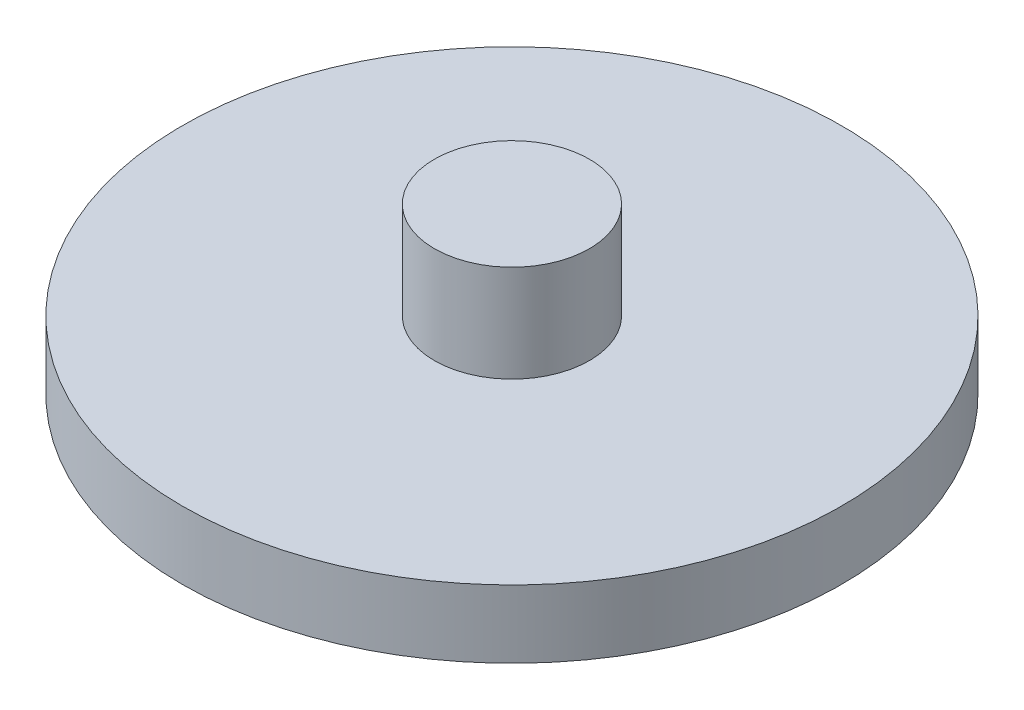
from build123d import *

# Parameters (mm, degrees)
SKETCH1_R           = 34
BOSS_EXTRUDE1_DEPTH = 7
SKETCH2_R           = 8
BOSS_EXTRUDE2_DEPTH = 10


with BuildPart() as part:
    # Sketch1 → Boss-Extrude1 (new body)
    with BuildSketch(Plane(origin=(0, 0, 0), x_dir=(1, 0, 0), z_dir=(0, 1, 0))):
        with Locations(Location((0, 0, 0), (0, 0, 270))):
            Circle(SKETCH1_R)
    extrude(amount=BOSS_EXTRUDE1_DEPTH)

    # Sketch2 → Boss-Extrude2 (add)
    with BuildSketch(Plane(origin=(0, 7, 0), x_dir=(1, 0, 0), z_dir=(0, 1, 0))):
        with Locations(Location((0, 0, 0), (0, 0, 270))):
            Circle(SKETCH2_R)
    extrude(amount=BOSS_EXTRUDE2_DEPTH)


solid = part.part
